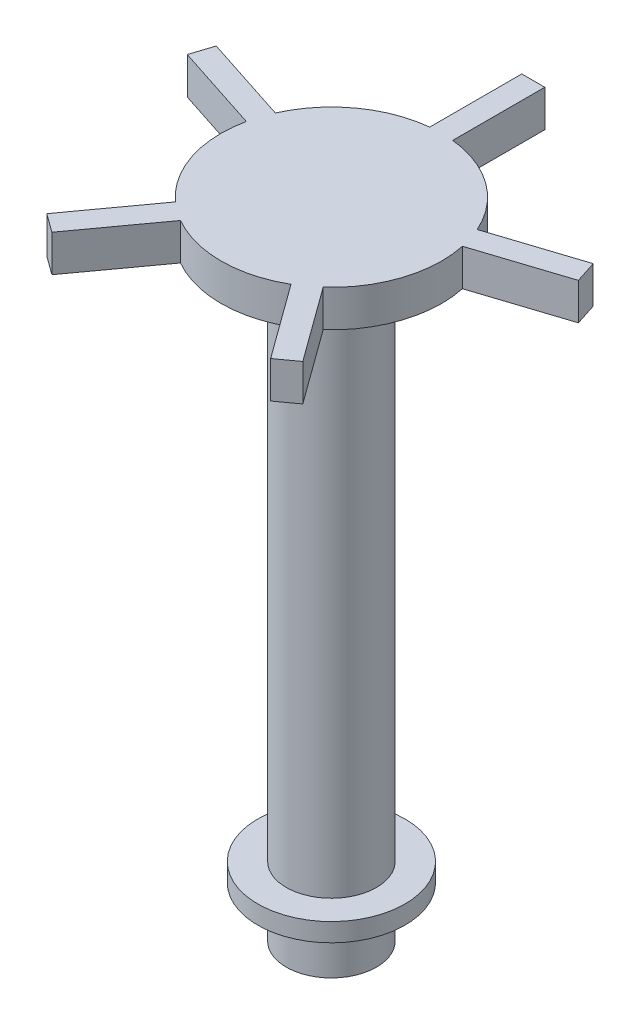
from build123d import *

# Parameters (mm, degrees)
SKETCH1_W           = 3.1
SKETCH1_H           = 2
BOSS_EXTRUDE1_DEPTH = 4
CIRPATTERN1_COUNT   = 5


with BuildPart() as part:
    # Sketch1 → Revolve1 (revolve)
    with BuildSketch(Plane.XY, mode=Mode.PRIVATE) as revolve1_sk:
        Polygon((0, 35), (0, -35), (-4.9, -35), (-4.9, 31), (-12, 31), (-12, 35), align=None)
        with Locations((-6.45, -28.5)):
            Rectangle(SKETCH1_W, SKETCH1_H)
    revolve(revolve1_sk.sketch.rotate(Axis((0, -35, 0), (0, 1, 0)), 270), axis=Axis((0, -35, 0), (0, 1, 0)))

    # Sketch2 → Boss-Extrude1 (add)
    with BuildSketch(Plane(origin=(0, 35, 0), x_dir=(1, 0, 0), z_dir=(0, 1, 0))):
        with BuildLine():
            Line((-1.25, 11.934718262), (-1.25, 21.934718262))
            Line((-1.25, 21.934718262), (1.25, 21.934718262))
            Line((1.25, 21.934718262), (1.25, 11.934718262))
            ThreePointArc((1.25, 11.934718262), (0, 12), (-1.25, 11.934718262))
        make_face()
    boss_extrude1 = extrude(amount=-BOSS_EXTRUDE1_DEPTH)

    # CirPattern1: Boss-Extrude1 ×5 about axis
    cirpattern1_axis = Axis((0, 0, 0), (0, 1, 0))
    for i in range(1, CIRPATTERN1_COUNT):
        add(boss_extrude1.rotate(cirpattern1_axis, i * 360 / CIRPATTERN1_COUNT))


solid = part.part
